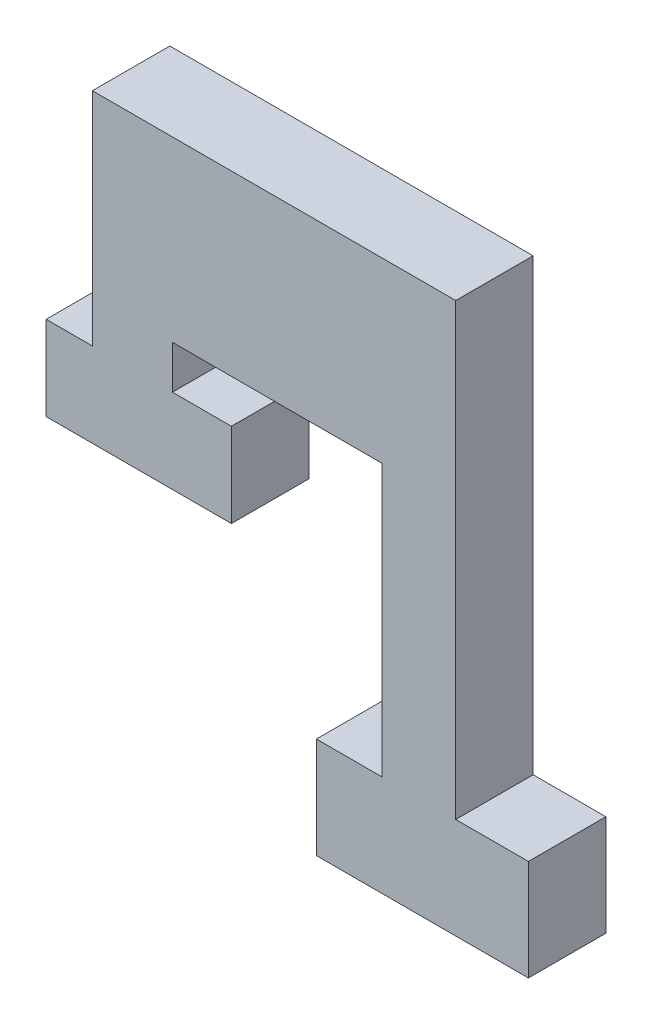
from build123d import *

# Parameters (mm, degrees)
BOSS_EXTRUDE1_DEPTH = 20
SKETCH3_W           = 47.8415773
SKETCH3_H           = 21.769183321
SKETCH3_W_2         = 54.74945498
SKETCH3_H_2         = 26.072393978
BOSS_EXTRUDE2_DEPTH = 20


with BuildPart() as part:
    # Sketch1 → Boss-Extrude1 (new body)
    with BuildSketch(Plane.XY):
        Polygon((-57.85830676, 0), (-57.85830676, 45.936170213), (35.982726675, 45.936170213), (35.982726675, -85.966261398), (16.952027587, -85.966261398), (16.952027587, 0), (-37.187030164, 0), (-37.187030164, -22.639969605), (-57.85830676, -22.639969605), align=None)
    extrude(amount=BOSS_EXTRUDE1_DEPTH)

    # Sketch3 → Boss-Extrude2 (add)
    with BuildSketch(Plane.XY):
        with Locations((-45.869735372, -22.040085901)):
            Rectangle(SKETCH3_W, SKETCH3_H)
        with Locations((27.37472749, -83.170990229)):
            Rectangle(SKETCH3_W_2, SKETCH3_H_2)
    extrude(amount=BOSS_EXTRUDE2_DEPTH)


solid = part.part
